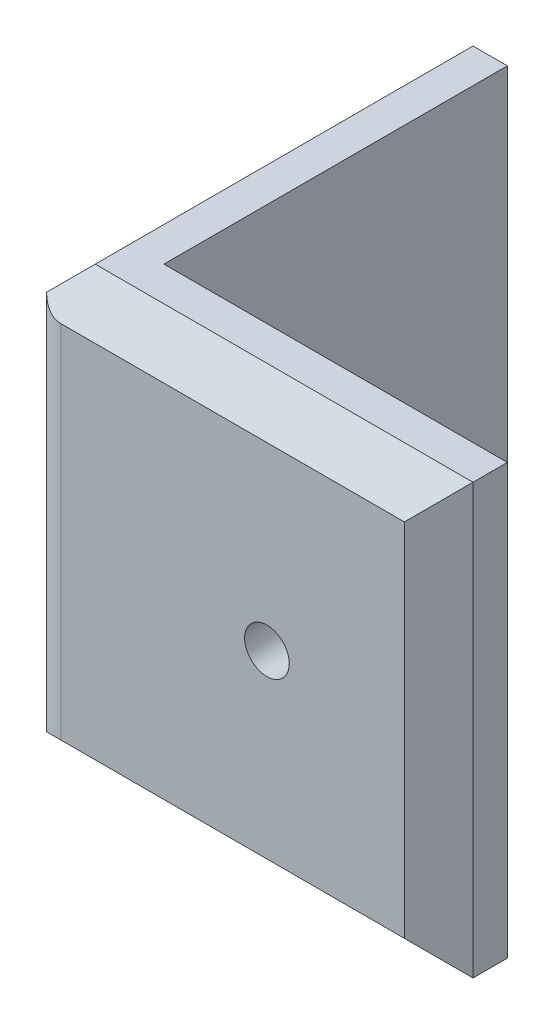
from build123d import *

# Parameters (mm, degrees)
BOSS_EXTRUDE1_DEPTH = 50
SKETCH2_R           = 2.6
CUT_EXTRUDE1_DEPTH  = 81.024996095
SKETCH3_R           = 2.6
CUT_EXTRUDE2_DEPTH  = 81.024996095
SKETCH4_R           = 12.5
SKETCH4_R_2         = 5.5
BOSS_EXTRUDE2_DEPTH = 8
BOSS_EXTRUDE2_DRAFT = 15
FILLET1_R           = 4
CHAMFER1_SIZE       = 4
FILLET2_R           = 4


with BuildPart() as part:
    # Sketch1 → Boss-Extrude1 (new body)
    with BuildSketch(Plane(origin=(0, 0, 0), x_dir=(1, 0, 0), z_dir=(0, 1, 0))):
        Polygon((-8, 40), (0, 40), (0, 0), (40, 0), (40, -8), (-8, -8), align=None)
    extrude(amount=BOSS_EXTRUDE1_DEPTH)

    # Sketch2 → Cut-Extrude1 (cut, through all)
    with BuildSketch(Plane.ZY.offset(8)):
        with Locations((-20, 25)):
            Circle(SKETCH2_R)
    extrude(amount=-CUT_EXTRUDE1_DEPTH, mode=Mode.SUBTRACT)

    # Sketch3 → Cut-Extrude2 (cut, through all)
    with BuildSketch(Plane.XY.offset(8)):
        with Locations((20, 25)):
            Circle(SKETCH3_R)
    extrude(amount=-CUT_EXTRUDE2_DEPTH, mode=Mode.SUBTRACT)


with BuildPart() as boss_extrude2_tool:
    # Sketch4 → Boss-Extrude2 (with draft: the straight prism first)
    with BuildSketch(Plane.ZY.offset(8)):
        with Locations((-20, 25)):
            Circle(SKETCH4_R)
        with Locations((-20, 25)):
            Circle(SKETCH4_R_2, mode=Mode.SUBTRACT)
    extrude(amount=BOSS_EXTRUDE2_DEPTH)
    # Boss-Extrude2: the draft: its side faces are tilted about the plane it starts from
    boss_extrude2_sides = [boss_extrude2_tool.faces().sort_by_distance(p)[0] for p in [
        (-12, 25, -32.5),
        (-12, 25, -25.5),
    ]]
    draft(boss_extrude2_sides, Plane.ZY.offset(8), BOSS_EXTRUDE2_DRAFT)


with BuildPart() as part_1:
    add(part.part)

    # Boss-Extrude2: add boss_extrude2_tool
    add(boss_extrude2_tool.part)

    # Fillet1
    fillet1_edges = [part_1.edges().sort_by_distance(p)[0] for p in [
        (-8, 25, -32.5),
    ]]
    fillet(fillet1_edges, radius=FILLET1_R)

    # Chamfer1
    chamfer1_edges = [part_1.edges().sort_by_distance(p)[0] for p in [
        (-8, 25, -40),
        (40, 25, 8),
        (-8, 50, -16),
        (16, 0, 8),
        (-8, 0, -16),
        (16, 50, 8),
    ]]
    chamfer(chamfer1_edges, length=CHAMFER1_SIZE)

    # Fillet2
    fillet2_edges = [part_1.edges().sort_by_distance(p)[0] for p in [
        (-8, 25, 8),
    ]]
    fillet(fillet2_edges, radius=FILLET2_R)


solid = part_1.part
